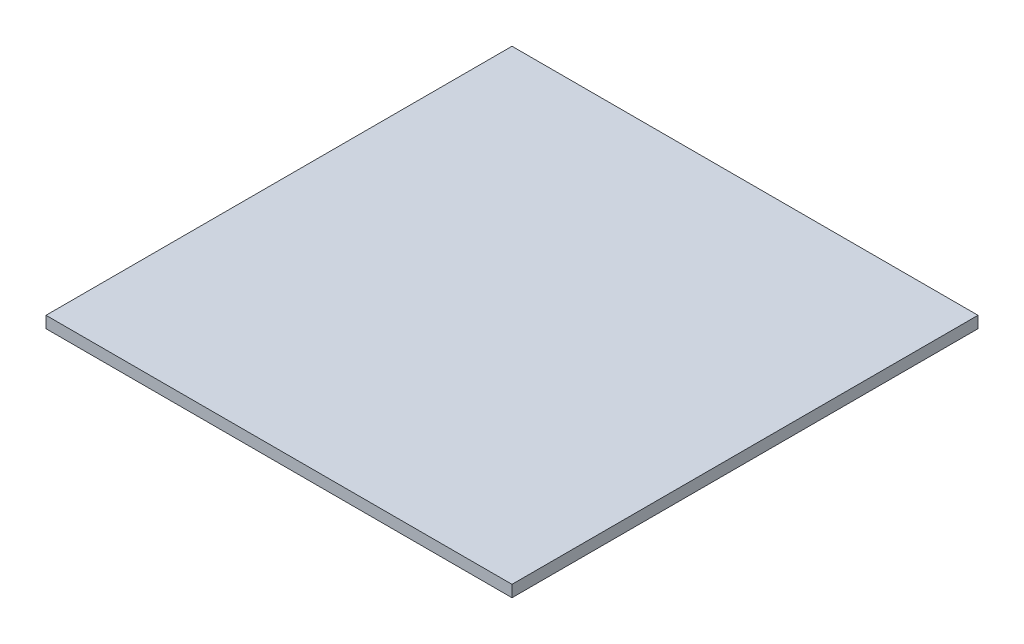
from build123d import *

# Parameters (mm, degrees)
SKETCH1_W           = 400
SKETCH1_H           = 400
BOSS_EXTRUDE1_DEPTH = 10


with BuildPart() as part:
    # Sketch1 → Boss-Extrude1 (new body)
    with BuildSketch(Plane(origin=(0, 0, 0), x_dir=(1, 0, 0), z_dir=(0, 1, 0))):
        Rectangle(SKETCH1_W, SKETCH1_H)
    extrude(amount=-BOSS_EXTRUDE1_DEPTH)


solid = part.part
